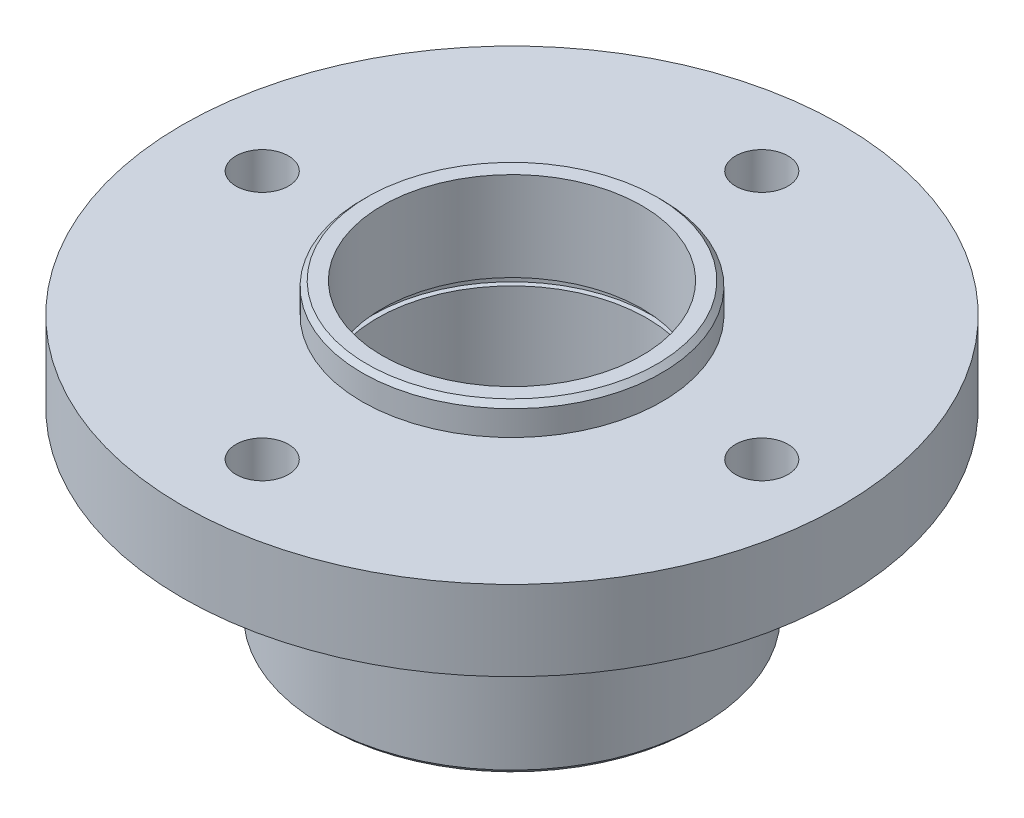
from build123d import *

# Parameters (mm, degrees)
OTW_R_GWINTOWANY_M12X1_51_D = 10.5


with BuildPart() as part:
    # Szkic1 → Obrót1 (revolve)
    with BuildSketch(Plane.XY, mode=Mode.PRIVATE) as obr_t1_sk:
        Polygon((30, 80.923148938), (66, 80.923148938), (66, 64.923148938), (38, 64.923148938), (38, 39.923148938), (38, 28.923148938), (37, 27.923148938), (24.5, 27.923148938), (24.5, 29.923148938), (27, 29.923148938), (27, 66.923148938), (28, 66.923148938), (28, 69.073148938), (26, 69.073148938), (26, 80.923148938), (26, 86.923148938), (29, 86.923148938), (30, 85.923148938), align=None)
    revolve(obr_t1_sk.sketch.rotate(Axis((0, 0, 0), (0, 1, 0)), 90), axis=Axis((0, 0, 0), (0, 1, 0)))

    # Otwór gwintowany M12x1.51 (through all)
    with Locations(Plane(origin=(-50, 80.923148938, 0), x_dir=(0, 0, 1), z_dir=(0, 1, 0))):
        with Locations((0, 0), (-50, 50), (0, 100), (50, 50)):
            Hole(OTW_R_GWINTOWANY_M12X1_51_D / 2)


solid = part.part
